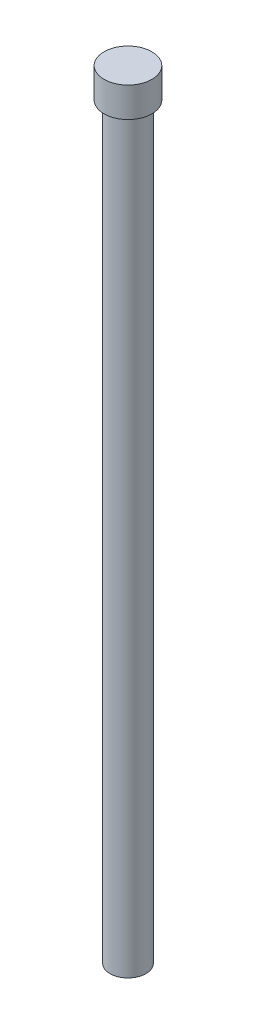
from build123d import *

# Parameters (mm, degrees)
SKETCH1_R           = 0.762
BOSS_EXTRUDE1_DEPTH = 31.75
SKETCH2_R           = 1.016
BOSS_EXTRUDE2_DEPTH = 1.27


with BuildPart() as part:
    # Sketch1 → Boss-Extrude1 (new body)
    with BuildSketch(Plane(origin=(0, 0, 0), x_dir=(1, 0, 0), z_dir=(0, 1, 0))):
        with Locations(Location((0, 0, 0), (0, 0, 270))):
            Circle(SKETCH1_R)
    extrude(amount=BOSS_EXTRUDE1_DEPTH)

    # Sketch2 → Boss-Extrude2 (add)
    with BuildSketch(Plane(origin=(0, 31.75, 0), x_dir=(1, 0, 0), z_dir=(0, 1, 0))):
        with Locations(Location((0, 0, 0), (0, 0, 270))):
            Circle(SKETCH2_R)
    extrude(amount=BOSS_EXTRUDE2_DEPTH)


solid = part.part
